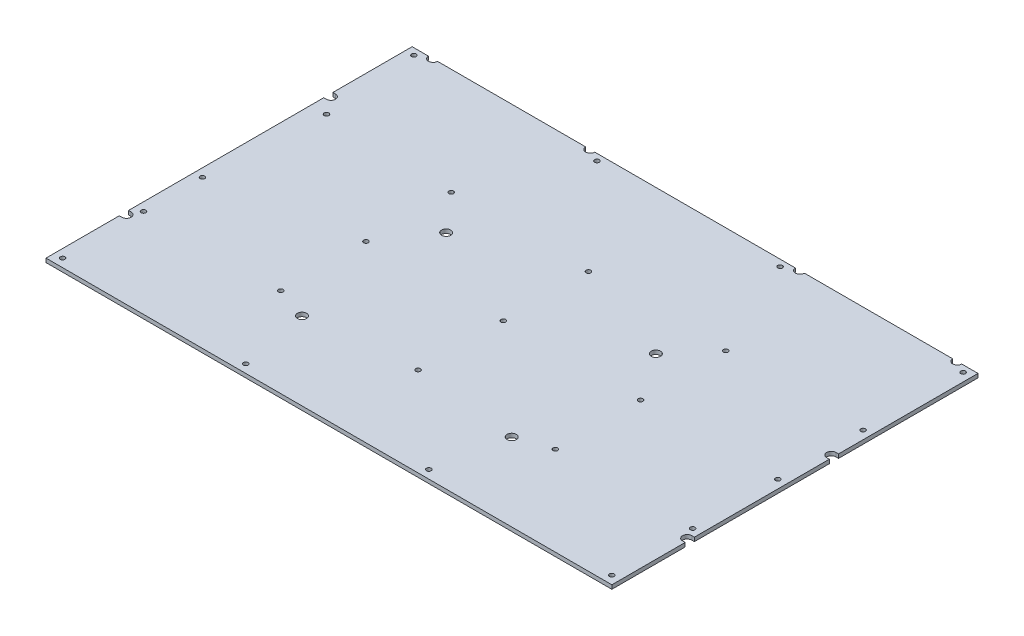
from build123d import *

# Parameters (mm, degrees)
SKETCH1_W            = 431.8
SKETCH1_H            = 294.7
BOSS_EXTRUDE1_DEPTH  = 3
SKETCH2_R            = 1.775
CUT_EXTRUDE1_DEPTH   = 262.407407125
LPATTERN1_COUNT      = 4
LPATTERN1_PITCH      = 139.7
SKETCH3_R            = 1.775
CUT_EXTRUDE2_DEPTH   = 262.407407125
LPATTERN2_COUNT      = 5
LPATTERN2_PITCH      = 104.77
LPATTERN2_COUNT_DIR2 = 3
LPATTERN2_PITCH_DIR2 = 65
SKETCH4_R            = 1.775
CUT_EXTRUDE3_DEPTH   = 10
SKETCH7_R            = 3.5
CUT_EXTRUDE5_DEPTH   = 262.407407125
SKETCH8_W            = 2
SKETCH8_H            = 7
CUT_EXTRUDE6_DEPTH   = 262.407407125
SKETCH9_W            = 431.8
SKETCH9_H            = 15.3
CUT_EXTRUDE7_DEPTH   = 262.407407125


with BuildPart() as part:
    # Sketch1 → Boss-Extrude1 (new body)
    with BuildSketch(Plane(origin=(0, 0, 0), x_dir=(1, 0, 0), z_dir=(0, 1, 0))):
        Rectangle(SKETCH1_W, SKETCH1_H)
    extrude(amount=BOSS_EXTRUDE1_DEPTH)

    # Sketch2 → Cut-Extrude1 (cut, through all)
    with BuildSketch(Plane(origin=(0, 3, 0), x_dir=(1, 0, 0), z_dir=(0, 1, 0))):
        with Locations(Location((-209.55, -125.7, 0), (0, 0, 270))):
            Circle(SKETCH2_R)
        with Locations(Location((-209.55, 142.35, 0), (0, 0, 270))):
            Circle(SKETCH2_R)
    cut_extrude1 = extrude(amount=-CUT_EXTRUDE1_DEPTH, mode=Mode.SUBTRACT)

    # LPattern1: Cut-Extrude1 ×4
    with Locations(*[(i * LPATTERN1_PITCH, 0, 0) for i in range(1, LPATTERN1_COUNT)]):
        add(cut_extrude1, mode=Mode.SUBTRACT)

    # Sketch3 → Cut-Extrude2 (cut, through all)
    with BuildSketch(Plane(origin=(0, 3, 0), x_dir=(1, 0, 0), z_dir=(0, 1, 0))):
        with Locations(Location((-209.55, -64, 0), (0, 0, 270))):
            Circle(SKETCH3_R)
    cut_extrude2 = extrude(amount=-CUT_EXTRUDE2_DEPTH, mode=Mode.SUBTRACT)

    # LPattern2: Cut-Extrude2 5 × 3, 2 skipped
    with Locations(*[(i * LPATTERN2_PITCH, 0, -j * LPATTERN2_PITCH_DIR2) for i in range(LPATTERN2_COUNT) for j in range(LPATTERN2_COUNT_DIR2) if (i, j) not in ((0, 0), (0, 1), (0, 2))]):
        add(cut_extrude2, mode=Mode.SUBTRACT)

    # Sketch4 → Cut-Extrude3 (cut)
    with BuildSketch(Plane(origin=(0, 3, 0), x_dir=(1, 0, 0), z_dir=(0, 1, 0))):
        with Locations(Location((-203.9, 70, 0), (0, 0, 270))):
            Circle(SKETCH4_R)
        with Locations(Location((-209.55, -19, 0), (0, 0, 270))):
            Circle(SKETCH4_R)
    extrude(amount=-CUT_EXTRUDE3_DEPTH, mode=Mode.SUBTRACT)

    # Sketch7 → Cut-Extrude5 (cut, through all)
    with BuildSketch(Plane.XZ):
        with Locations((-213.9, -83.38)):
            Circle(SKETCH7_R)
        with Locations((-213.9, 72.58)):
            Circle(SKETCH7_R)
        with Locations((213.9, 72.58)):
            Circle(SKETCH7_R)
        with Locations((213.9, -37.42)):
            Circle(SKETCH7_R)
        with Locations((200, -147.42)):
            Circle(SKETCH7_R)
        with Locations((80, -147.42)):
            Circle(SKETCH7_R)
        with Locations((-80, -147.42)):
            Circle(SKETCH7_R)
        with Locations(Location((-80, -37.42, 0), (0, 0, 270))):
            Circle(SKETCH7_R)
        with Locations(Location((80, -37.42, 0), (0, 0, 270))):
            Circle(SKETCH7_R)
        with Locations(Location((80, 72.58, 0), (0, 0, 270))):
            Circle(SKETCH7_R)
        with Locations(Location((-80, 72.58, 0), (0, 0, 270))):
            Circle(SKETCH7_R)
        with Locations((-200, -147.42)):
            Circle(SKETCH7_R)
    extrude(amount=-CUT_EXTRUDE5_DEPTH, mode=Mode.SUBTRACT)

    # Sketch8 → Cut-Extrude6 (cut, through all)
    with BuildSketch(Plane(origin=(0, 3, 0), x_dir=(1, 0, 0), z_dir=(0, 1, 0))):
        with Locations((214.9, 37.42)):
            Rectangle(SKETCH8_W, SKETCH8_H)
        with Locations((214.9, -72.58)):
            Rectangle(SKETCH8_W, SKETCH8_H)
        with Locations((-214.9, 83.38)):
            Rectangle(SKETCH8_W, SKETCH8_H)
        with Locations((-214.9, -72.58)):
            Rectangle(SKETCH8_W, SKETCH8_H)
    extrude(amount=-CUT_EXTRUDE6_DEPTH, mode=Mode.SUBTRACT)

    # Sketch9 → Cut-Extrude7 (cut, through all)
    with BuildSketch(Plane.XZ):
        with Locations((0, 139.7)):
            Rectangle(SKETCH9_W, SKETCH9_H)
    extrude(amount=-CUT_EXTRUDE7_DEPTH, mode=Mode.SUBTRACT)


solid = part.part
